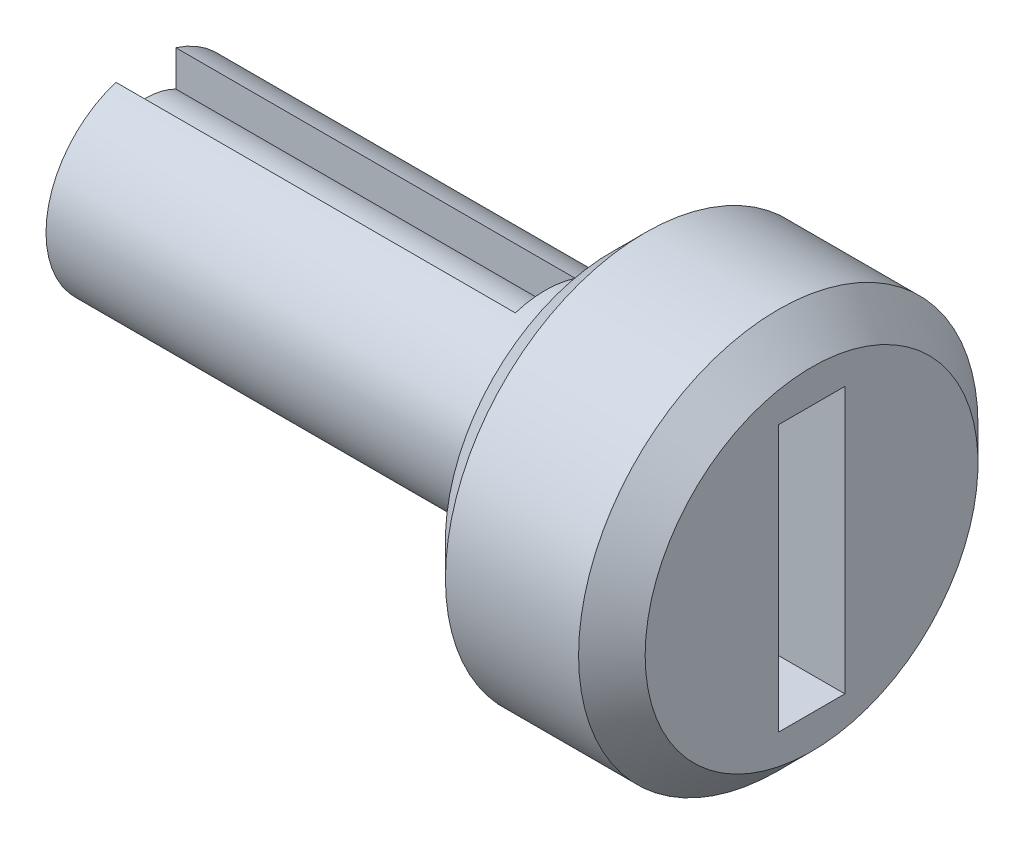
from build123d import *

# Parameters (mm, degrees)
SKETCH3_R          = 1.2
CUT_EXTRUDE1_DEPTH = 14
SKETCH4_W          = 2
SKETCH4_H          = 8
CUT_EXTRUDE2_DEPTH = 4
CHAMFER1_SIZE      = 1
CUT_EXTRUDE3_START = -12
CUT_EXTRUDE3_DEPTH = 12


with BuildPart() as part:
    # Sketch2 → Revolve1 (revolve)
    with BuildSketch(Plane(origin=(0, 0, 0), x_dir=(1, 0, 0), z_dir=(0, 1, 0)), mode=Mode.PRIVATE) as revolve1_sk:
        Polygon((0, 0), (0, 3), (14, 3), (14, 6), (20, 6), (20, 0), align=None)
    revolve(revolve1_sk.sketch.rotate(Axis((0, 0, 0), (1, 0, 0)), 180), axis=Axis((0, 0, 0), (1, 0, 0)))

    # Sketch3 → Cut-Extrude1 (cut)
    with BuildSketch(Plane.ZY):
        Circle(SKETCH3_R)
    extrude(amount=-CUT_EXTRUDE1_DEPTH, mode=Mode.SUBTRACT)

    # Sketch4 → Cut-Extrude2 (cut)
    with BuildSketch(Plane(origin=(20, 0, 0), x_dir=(0, 0, -1), z_dir=(1, 0, 0))):
        Rectangle(SKETCH4_W, SKETCH4_H)
    extrude(amount=-CUT_EXTRUDE2_DEPTH, mode=Mode.SUBTRACT)

    # Chamfer1
    chamfer1_edges = [part.edges().sort_by_distance(p)[0] for p in [
        (20, 0, -6),
        (14, 0, -6),
    ]]
    chamfer(chamfer1_edges, length=CHAMFER1_SIZE)

    # Sketch5 → Cut-Extrude3 (cut)
    with BuildSketch(Plane.ZY.offset(CUT_EXTRUDE3_START)):
        with BuildLine():
            Line((-0.9, 2.861817604), (-0.9, 1.78605711))
            ThreePointArc((-0.9, 1.78605711), (0, 2), (0.9, 1.78605711))
            Line((0.9, 1.78605711), (0.9, 2.861817604))
            ThreePointArc((0.9, 2.861817604), (0, 3), (-0.9, 2.861817604))
        make_face()
        with BuildLine():
            Line((-0.9, -1.78605711), (-0.9, -2.861817604))
            ThreePointArc((-0.9, -2.861817604), (0, -3), (0.9, -2.861817604))
            Line((0.9, -2.861817604), (0.9, -1.78605711))
            ThreePointArc((0.9, -1.78605711), (0, -2), (-0.9, -1.78605711))
        make_face()
    extrude(amount=CUT_EXTRUDE3_DEPTH, mode=Mode.SUBTRACT)


solid = part.part
